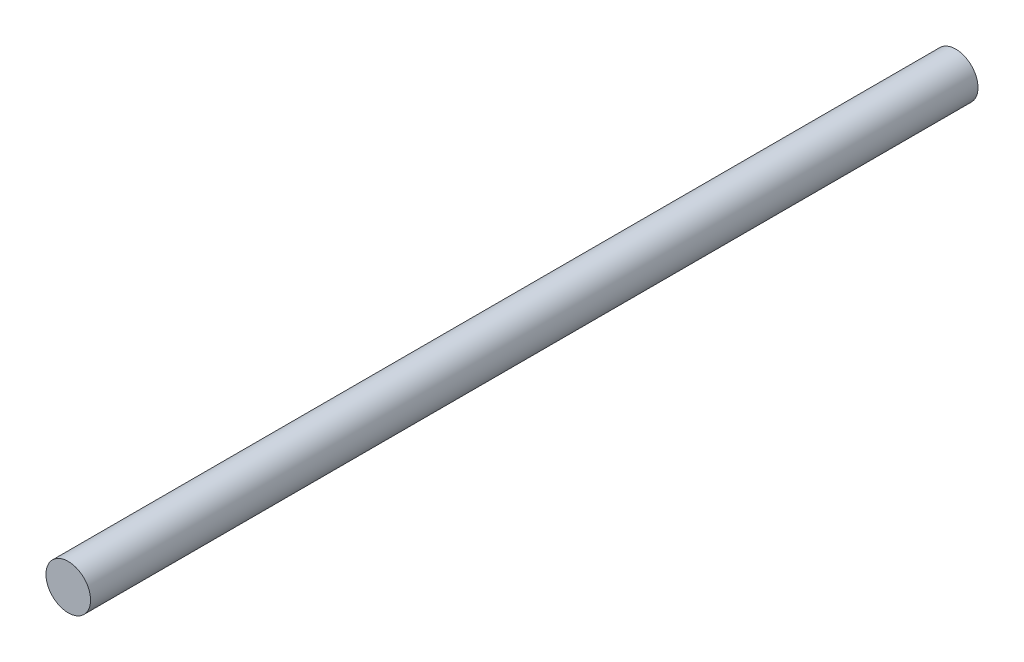
from build123d import *

# Parameters (mm, degrees)
SKETCH2_R           = 1
BOSS_EXTRUDE1_DEPTH = 39.8018


with BuildPart() as part:
    # Sketch2 → Boss-Extrude1 (new body)
    with BuildSketch(Plane.XY):
        Circle(SKETCH2_R)
    extrude(amount=BOSS_EXTRUDE1_DEPTH)


solid = part.part
